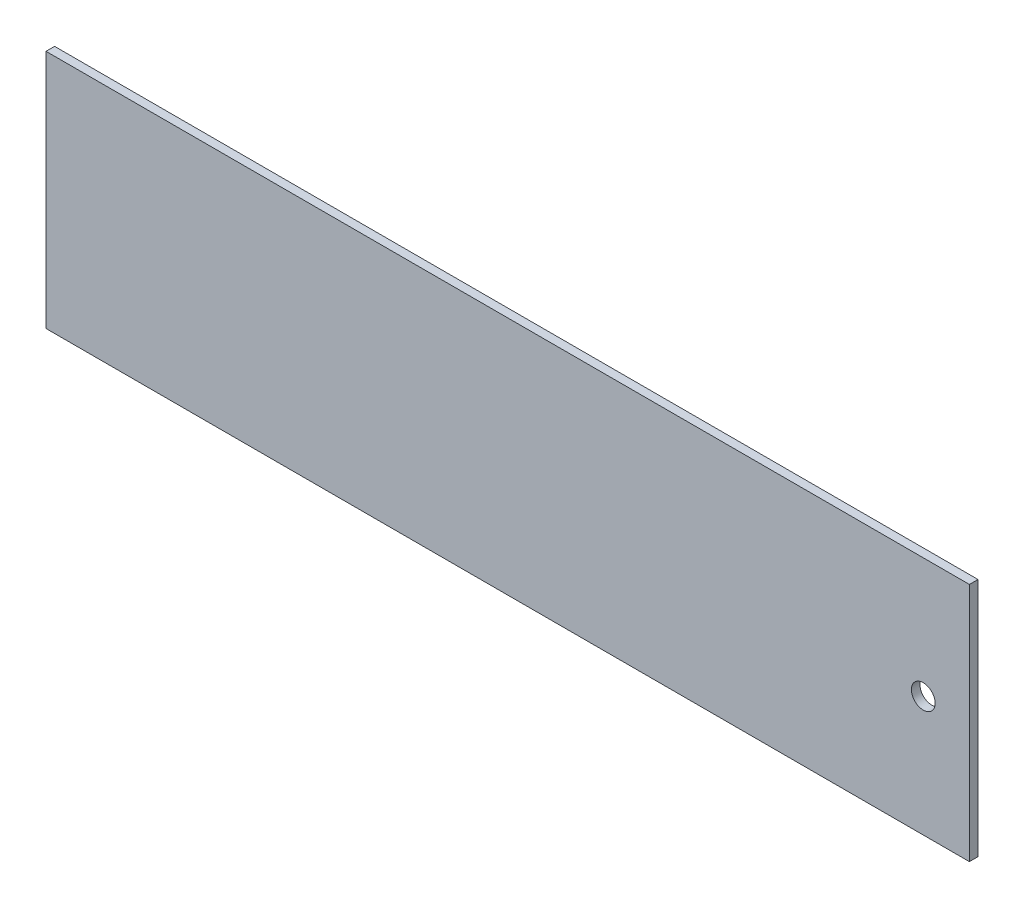
from build123d import *

# Parameters (mm, degrees)
SKETCH2_W           = 254
SKETCH2_H           = 66.04
BOSS_EXTRUDE1_DEPTH = 2.3622
SKETCH3_R           = 3.2639
CUT_EXTRUDE1_DEPTH  = 263.455446864


with BuildPart() as part:
    # Sketch2 → Boss-Extrude1 (new body)
    with BuildSketch(Plane.XY):
        with Locations((-127, 33.02)):
            Rectangle(SKETCH2_W, SKETCH2_H)
    extrude(amount=BOSS_EXTRUDE1_DEPTH)

    # Sketch3 → Cut-Extrude1 (cut, through all)
    with BuildSketch(Plane.XY.offset(2.3622)):
        with Locations((-12.7, 33.02)):
            Circle(SKETCH3_R)
    extrude(amount=-CUT_EXTRUDE1_DEPTH, mode=Mode.SUBTRACT)


solid = part.part
